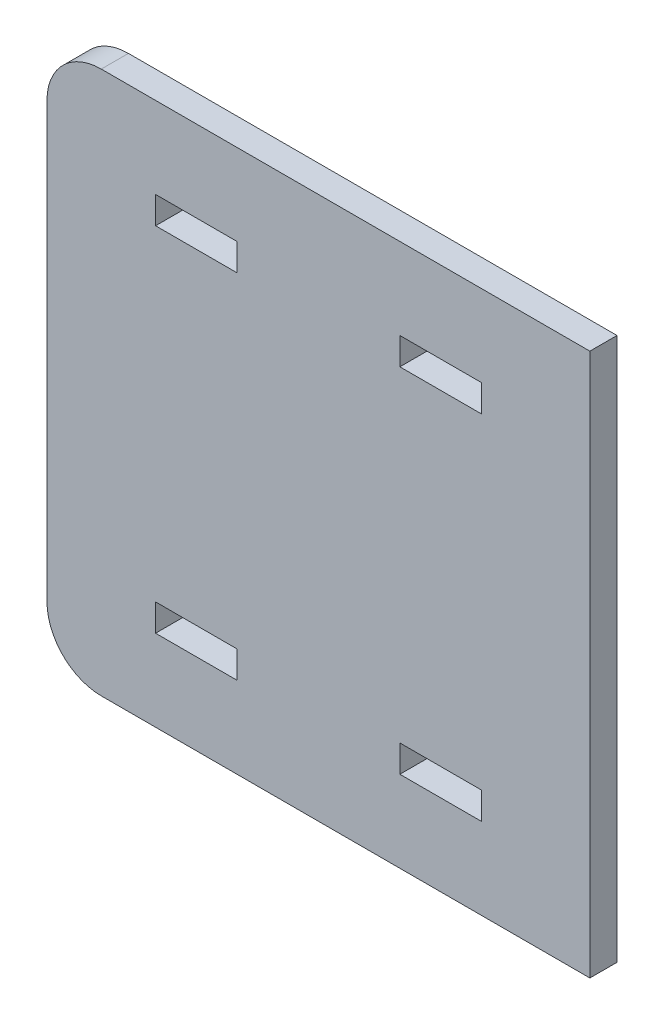
from build123d import *

# Parameters (mm, degrees)
SKETCH1_W           = 100
SKETCH1_H           = 100
SKETCH1_W_2         = 15
SKETCH1_H_2         = 5
BOSS_EXTRUDE1_DEPTH = 5
FILLET1_R           = 10


with BuildPart() as part:
    # Sketch1 → Boss-Extrude1 (new body)
    with BuildSketch(Plane.XY):
        with Locations((50, 50)):
            Rectangle(SKETCH1_W, SKETCH1_H)
        with Locations((72.5, 82.5)):
            Rectangle(SKETCH1_W_2, SKETCH1_H_2, mode=Mode.SUBTRACT)
        with Locations((27.5, 17.5)):
            Rectangle(SKETCH1_W_2, SKETCH1_H_2, mode=Mode.SUBTRACT)
        with Locations((72.5, 17.5)):
            Rectangle(SKETCH1_W_2, SKETCH1_H_2, mode=Mode.SUBTRACT)
        with Locations((27.5, 82.5)):
            Rectangle(SKETCH1_W_2, SKETCH1_H_2, mode=Mode.SUBTRACT)
    extrude(amount=BOSS_EXTRUDE1_DEPTH)

    # Fillet1
    fillet1_edges = [part.edges().sort_by_distance(p)[0] for p in [
        (0, 100, 2.5),
        (0, 0, 2.5),
    ]]
    fillet(fillet1_edges, radius=FILLET1_R)


solid = part.part
